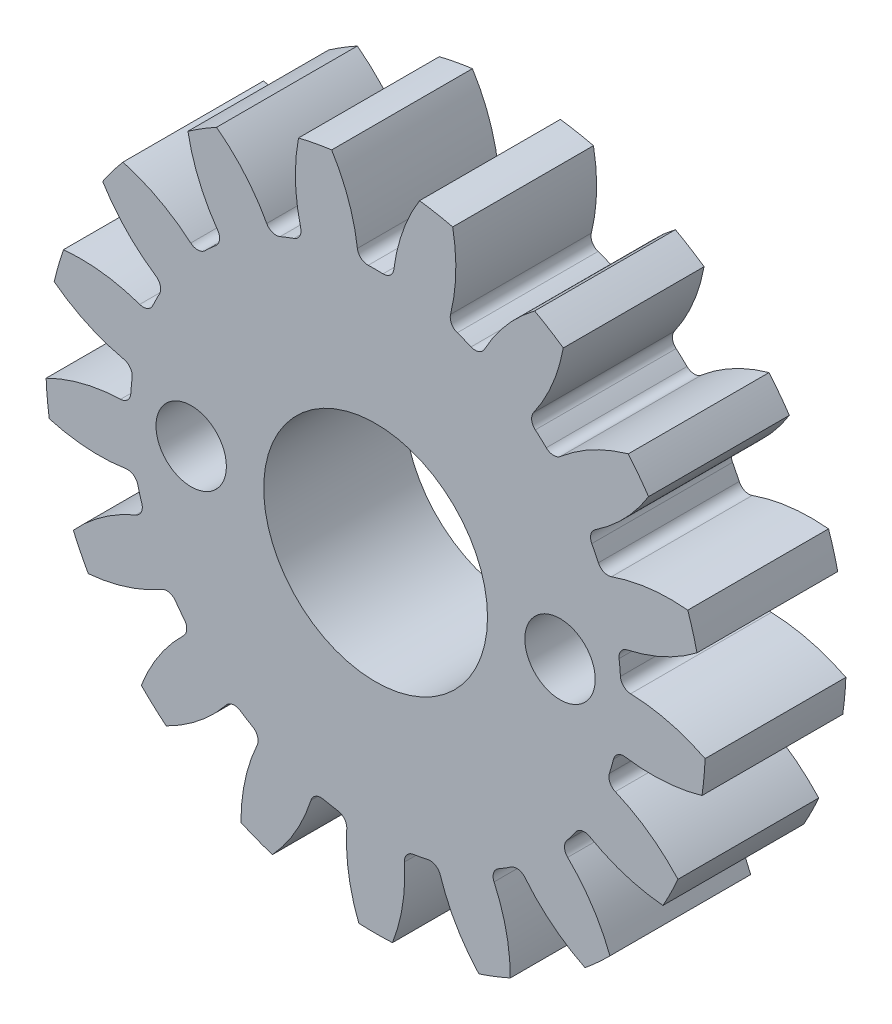
from build123d import *

# Parameters (mm, degrees)
SKETCH1_R                = 4.685
BOSS_EXTRUDE1_DEPTH      = 1
CUT_EXTRUDE1_DEPTH       = 7.700630567
FILLET1_R                = 0.15
CIRPATTERN1_COUNT        = 17
FILLET1_OF_CIRPATTERN1_R = 0.15
SKETCH6_R                = 0.5
CUT_EXTRUDE3_DEPTH       = 7.918168395
SKETCH8_R                = 1.59
CUT_EXTRUDE4_DEPTH       = 10


with BuildPart() as part:
    # Sketch1 → Boss-Extrude1 (new, symmetric)
    with BuildSketch(Plane.XY):
        Circle(SKETCH1_R)
    extrude(amount=BOSS_EXTRUDE1_DEPTH, both=True)

    # Sketch3 → Cut-Extrude1 (cut, symmetric)
    with BuildSketch(Plane.XY):
        with BuildLine():
            ThreePointArc((0.245193984, 3.476363748), (0, 3.485), (-0.245193984, 3.476363748))
            ThreePointArc((-0.245193984, 3.476363748), (-0.363341574, 4.083017365), (-0.624470365, 4.643195211))
            ThreePointArc((-0.624470365, 4.643195211), (0, 4.685), (0.624470365, 4.643195211))
            ThreePointArc((0.624470365, 4.643195211), (0.363341574, 4.083017365), (0.245193984, 3.476363748))
        make_face()
    cut_extrude1 = extrude(amount=CUT_EXTRUDE1_DEPTH, both=True, mode=Mode.SUBTRACT)

    # Fillet1
    fillet1_edges = [part.edges().sort_by_distance(p)[0] for p in [
        (0.245193984, 3.476363748, 0),
        (-0.245193984, 3.476363748, 0),
    ]]
    fillet(fillet1_edges, radius=FILLET1_R)

    # CirPattern1: Cut-Extrude1 ×17 about axis
    cirpattern1_axis = Axis((0, 0, 0), (0, 0, 1))
    for i in range(1, CIRPATTERN1_COUNT):
        add(cut_extrude1.rotate(cirpattern1_axis, i * 360 / CIRPATTERN1_COUNT), mode=Mode.SUBTRACT)

    # Fillet1 of CirPattern1
    fillet1_of_cirpattern1_edges = [part.edges().sort_by_distance(p)[0] for p in [
        (-1.027170851, 3.330186938, 0),
        (-1.484444014, 3.153038371, 0),
        (-2.160810572, 2.734249929, 0),
        (-2.523211654, 2.40387769, 0),
        (-3.002620851, 1.769037315, 0),
        (-3.221205578, 1.330060007, 0),
        (-3.438910547, 0.56490641, 0),
        (-3.48415784, 0.07661035, 0),
        (-3.410756317, -0.715518236, 0),
        (-3.276555279, -1.18718596, 0),
        (-2.921960547, -1.89930818, 0),
        (-2.626435772, -2.290646227, 0),
        (-2.038537814, -2.826586029, 0),
        (-1.62160156, -3.084742028, 0),
        (-0.879799253, -3.372117773, 0),
        (-0.397761072, -3.462226326, 0),
        (0.397761072, -3.462226326, 0),
        (0.879799253, -3.372117773, 0),
        (1.62160156, -3.084742028, 0),
        (2.038537814, -2.826586029, 0),
        (2.626435772, -2.290646227, 0),
        (2.921960547, -1.89930818, 0),
        (3.276555279, -1.18718596, 0),
        (3.410756317, -0.715518236, 0),
        (3.48415784, 0.07661035, 0),
        (3.438910547, 0.56490641, 0),
        (3.221205578, 1.330060007, 0),
        (3.002620851, 1.769037315, 0),
        (2.523211654, 2.40387769, 0),
        (2.160810572, 2.734249929, 0),
        (1.484444014, 3.153038371, 0),
        (1.027170851, 3.330186938, 0),
    ]]
    fillet(fillet1_of_cirpattern1_edges, radius=FILLET1_OF_CIRPATTERN1_R)

    # Sketch6 → Cut-Extrude3 (cut, through all)
    with BuildSketch(Plane.XY.offset(1)):
        with Locations((-2.620140081, 0)):
            Circle(SKETCH6_R)
        with Locations(Location((2.620140081, 0, 0), (0, 0, 180))):
            Circle(SKETCH6_R)
    extrude(amount=-CUT_EXTRUDE3_DEPTH, mode=Mode.SUBTRACT)

    # Sketch8 → Cut-Extrude4 (cut)
    with BuildSketch(Plane.XY.offset(1)):
        Circle(SKETCH8_R)
    extrude(amount=-CUT_EXTRUDE4_DEPTH, mode=Mode.SUBTRACT)


solid = part.part
